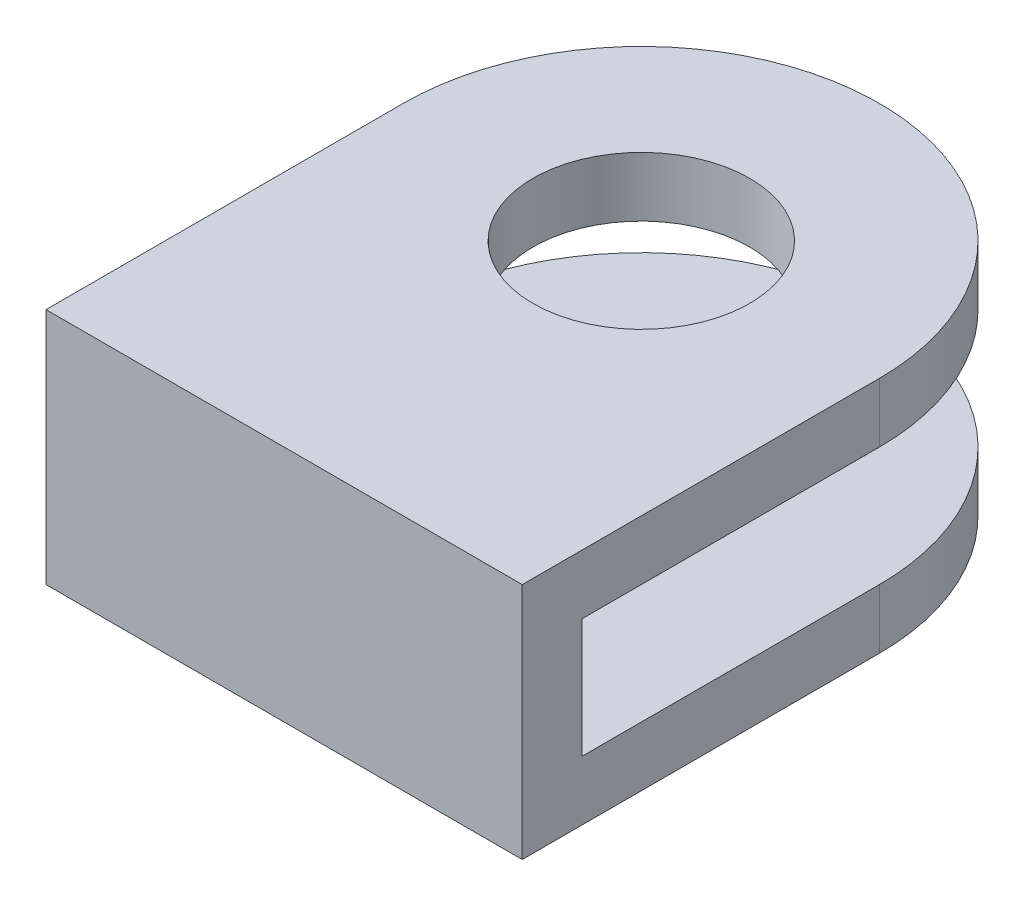
from build123d import *

# Parameters (mm, degrees)
SKETCH1_R           = 5.78131598
BOSS_EXTRUDE1_DEPTH = 12.7
SKETCH2_W           = 28.575
SKETCH2_H           = 6.35
CUT_EXTRUDE1_DEPTH  = 33.528


with BuildPart() as part:
    # Sketch1 → Boss-Extrude1 (new body)
    with BuildSketch(Plane(origin=(0, 0, 0), x_dir=(1, 0, 0), z_dir=(0, 1, 0))):
        with BuildLine():
            Line((-36.7158591, 9.525), (-62.1158591, 9.525))
            Line((-62.1158591, 9.525), (-62.1158591, 28.575))
            ThreePointArc((-62.1158591, 28.575), (-49.4158591, 41.275), (-36.7158591, 28.575))
            Line((-36.7158591, 28.575), (-36.7158591, 9.525))
        make_face()
        with Locations((-49.4158591, 28.575)):
            Circle(SKETCH1_R, mode=Mode.SUBTRACT)
    extrude(amount=BOSS_EXTRUDE1_DEPTH)

    # Sketch2 → Cut-Extrude1 (cut)
    with BuildSketch(Plane(origin=(-36.7158591, 0, 0), x_dir=(0, 0, -1), z_dir=(1, 0, 0))):
        with Locations((26.9875, 6.35)):
            Rectangle(SKETCH2_W, SKETCH2_H)
    extrude(amount=-CUT_EXTRUDE1_DEPTH, mode=Mode.SUBTRACT)


solid = part.part
